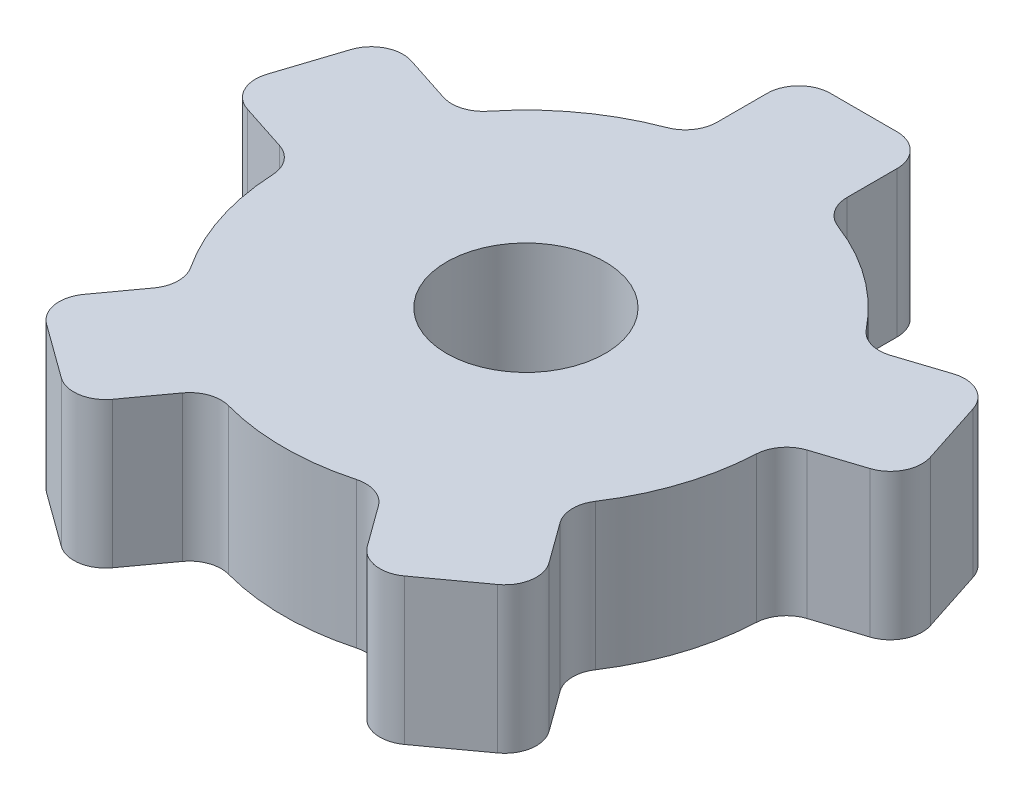
from build123d import *

# Parameters (mm, degrees)
SKETCH2_R           = 6.35
BOSS_EXTRUDE3_DEPTH = 11.684
FILLET1_R           = 2.54


with BuildPart() as part:
    # Sketch2 → Boss-Extrude3 (new body)
    with BuildSketch(Plane(origin=(0, 0, 0), x_dir=(1, 0, 0), z_dir=(0, 1, 0))):
        with BuildLine():
            Line((-5.207, 27.051), (5.207, 27.051))
            Line((5.207, 27.051), (5.207, 18.669))
            ThreePointArc((5.207, 18.669), (11.392188189, 15.680001858), (16.146222613, 10.721189548))
            Line((16.146222613, 10.721189548), (24.117978333, 13.311369995))
            Line((24.117978333, 13.311369995), (27.336081312, 3.407067434))
            Line((27.336081312, 3.407067434), (19.364325592, 0.816886988))
            ThreePointArc((19.364325592, 0.816886988), (18.432947696, -5.989227766), (15.185914365, -12.042940459))
            Line((15.185914365, -12.042940459), (20.112730349, -18.824120906))
            Line((20.112730349, -18.824120906), (11.68762737, -24.945316524))
            Line((11.68762737, -24.945316524), (6.760811385, -18.164136077))
            ThreePointArc((6.760811385, -18.164136077), (0, -19.381548184), (-6.760811385, -18.164136077))
            Line((-6.760811385, -18.164136077), (-11.68762737, -24.945316524))
            Line((-11.68762737, -24.945316524), (-20.112730349, -18.824120906))
            Line((-20.112730349, -18.824120906), (-15.185914365, -12.042940459))
            ThreePointArc((-15.185914365, -12.042940459), (-18.432947696, -5.989227766), (-19.364325592, 0.816886988))
            Line((-19.364325592, 0.816886988), (-27.336081312, 3.407067434))
            Line((-27.336081312, 3.407067434), (-24.117978333, 13.311369995))
            Line((-24.117978333, 13.311369995), (-16.146222613, 10.721189548))
            ThreePointArc((-16.146222613, 10.721189548), (-11.392188189, 15.680001858), (-5.207, 18.669))
            Line((-5.207, 18.669), (-5.207, 27.051))
        make_face()
        with Locations(Location((0, 0, 0), (0, 0, 270))):
            Circle(SKETCH2_R, mode=Mode.SUBTRACT)
    extrude(amount=BOSS_EXTRUDE3_DEPTH)

    # Fillet1
    fillet1_edges = [part.edges().sort_by_distance(p)[0] for p in [
        (-5.207, 5.842, -27.051),
        (5.207, 5.842, -27.051),
        (5.207, 5.842, -18.669),
        (16.146222613, 5.842, -10.721189548),
        (24.117978333, 5.842, -13.311369995),
        (27.336081312, 5.842, -3.407067434),
        (19.364325592, 5.842, -0.816886988),
        (15.185914365, 5.842, 12.042940459),
        (20.112730349, 5.842, 18.824120906),
        (11.68762737, 5.842, 24.945316524),
        (6.760811385, 5.842, 18.164136077),
        (-6.760811385, 5.842, 18.164136077),
        (-11.68762737, 5.842, 24.945316524),
        (-20.112730349, 5.842, 18.824120906),
        (-15.185914365, 5.842, 12.042940459),
        (-19.364325592, 5.842, -0.816886988),
        (-27.336081312, 5.842, -3.407067434),
        (-24.117978333, 5.842, -13.311369995),
        (-16.146222613, 5.842, -10.721189548),
        (-5.207, 5.842, -18.669),
    ]]
    fillet(fillet1_edges, radius=FILLET1_R)


solid = part.part
